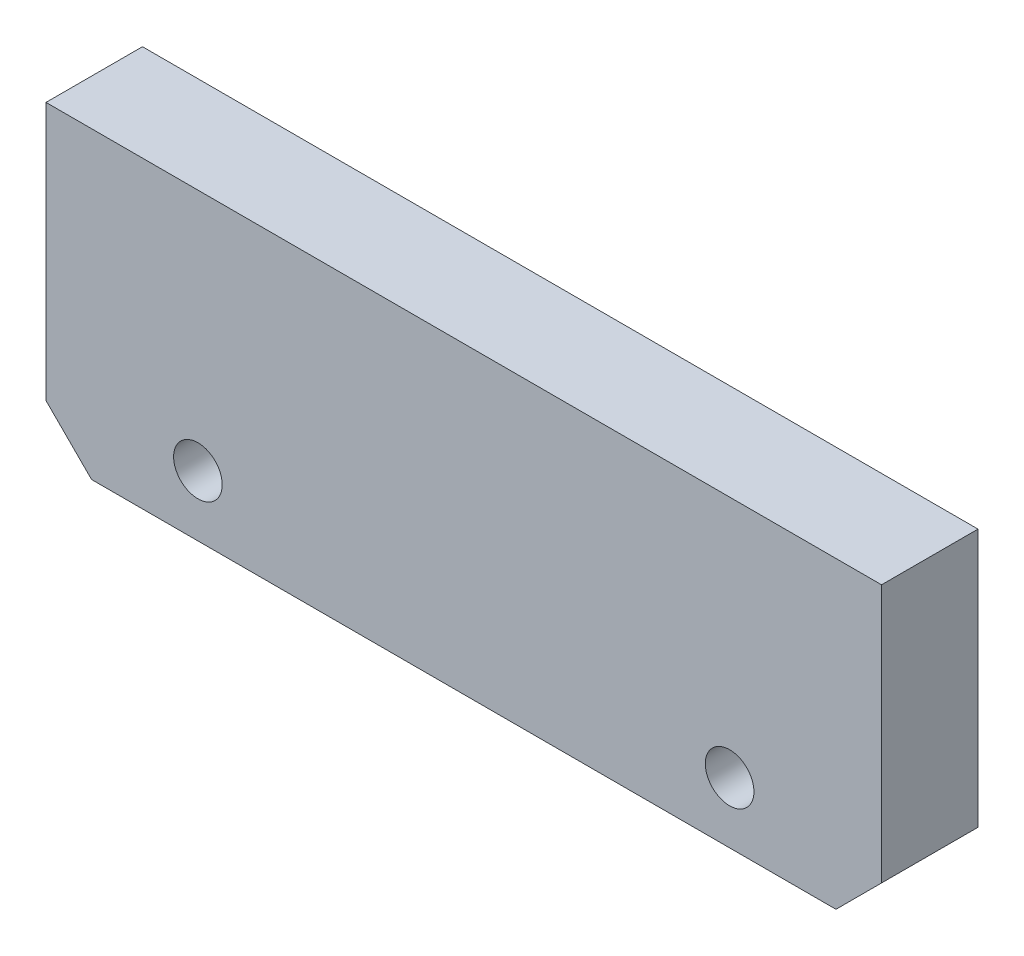
from build123d import *

# Parameters (mm, degrees)
SKETCH1_W             = 55
SKETCH1_H             = 20
BOSS_EXTRUDE1_DEPTH   = 6.35
F_3_0MM_DOWEL_HOLE1_D = 3.2
CHAMFER1_SIZE         = 3


with BuildPart() as part:
    # Sketch1 → Boss-Extrude1 (new body)
    with BuildSketch(Plane.XY):
        with Locations((27.5, -10)):
            Rectangle(SKETCH1_W, SKETCH1_H)
    extrude(amount=BOSS_EXTRUDE1_DEPTH)

    # Ø3.0mm Dowel Hole1 (through all)
    with Locations(Plane.XY.offset(6.35)):
        with Locations((10, -16), (45, -16)):
            Hole(F_3_0MM_DOWEL_HOLE1_D / 2)

    # Chamfer1
    chamfer1_edges = [part.edges().sort_by_distance(p)[0] for p in [
        (55, -20, 3.175),
        (0, -20, 3.175),
    ]]
    chamfer(chamfer1_edges, length=CHAMFER1_SIZE)


solid = part.part
